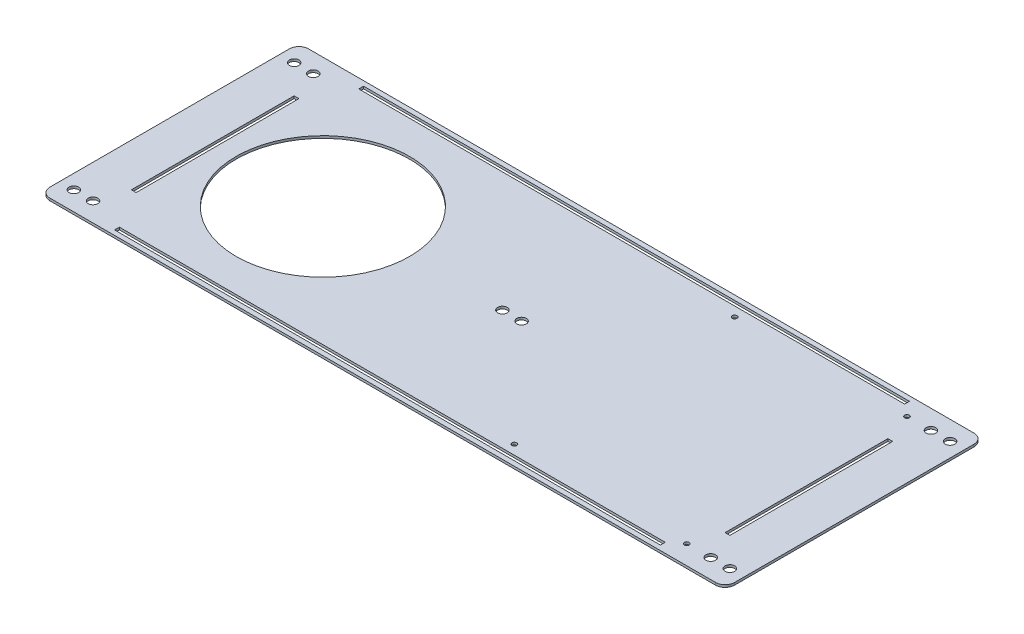
from build123d import *

# Parameters (mm, degrees)
SKETCH1_W           = 454.025
SKETCH1_H           = 171.45
BOSS_EXTRUDE1_DEPTH = 1.5875
FILLET1_R           = 6.35
SKETCH3_W           = 361.95
SKETCH3_H           = 3.175
SKETCH3_W_2         = 3.175
SKETCH3_H_2         = 107.95
CUT_EXTRUDE1_DEPTH  = 486.320845711
SKETCH4_R           = 3.175
CUT_EXTRUDE2_DEPTH  = 486.320845711
SKETCH6_R           = 1.5875
CUT_EXTRUDE3_DEPTH  = 486.320845711
SKETCH7_R           = 57.5
CUT_EXTRUDE4_DEPTH  = 486.320845711


with BuildPart() as part:
    # Sketch1 → Boss-Extrude1 (new body)
    with BuildSketch(Plane(origin=(0, 0, 0), x_dir=(1, 0, 0), z_dir=(0, 1, 0))):
        with Locations((227.0125, 85.725)):
            Rectangle(SKETCH1_W, SKETCH1_H)
    extrude(amount=BOSS_EXTRUDE1_DEPTH)

    # Fillet1
    fillet1_edges = [part.edges().sort_by_distance(p)[0] for p in [
        (0, 0.79375, -171.45),
        (454.025, 0.79375, -171.45),
        (454.025, 0.79375, 0),
        (0, 0.79375, 0),
    ]]
    fillet(fillet1_edges, radius=FILLET1_R)

    # Sketch3 → Cut-Extrude1 (cut, through all)
    with BuildSketch(Plane(origin=(0, 1.5875, 0), x_dir=(1, 0, 0), z_dir=(0, 1, 0))):
        with Locations((227.0125, 166.6875)):
            Rectangle(SKETCH3_W, SKETCH3_H)
        with Locations((30.1625, 85.725)):
            Rectangle(SKETCH3_W_2, SKETCH3_H_2)
        with Locations((227.0125, 4.7625)):
            Rectangle(SKETCH3_W, SKETCH3_H)
        with Locations((423.8625, 85.725)):
            Rectangle(SKETCH3_W_2, SKETCH3_H_2)
    extrude(amount=-CUT_EXTRUDE1_DEPTH, mode=Mode.SUBTRACT)

    # Sketch4 → Cut-Extrude2 (cut, through all)
    with BuildSketch(Plane(origin=(0, 1.5875, 0), x_dir=(1, 0, 0), z_dir=(0, 1, 0))):
        with Locations(Location((9.525, 158.75, 0), (0, 0, 270))):
            Circle(SKETCH4_R)
        with Locations(Location((22.225, 158.75, 0), (0, 0, 270))):
            Circle(SKETCH4_R)
        with Locations(Location((431.8, 158.75, 0), (0, 0, 270))):
            Circle(SKETCH4_R)
        with Locations(Location((444.5, 158.75, 0), (0, 0, 270))):
            Circle(SKETCH4_R)
        with Locations(Location((431.8, 12.7, 0), (0, 0, 270))):
            Circle(SKETCH4_R)
        with Locations(Location((444.5, 12.7, 0), (0, 0, 270))):
            Circle(SKETCH4_R)
        with Locations(Location((9.525, 12.7, 0), (0, 0, 270))):
            Circle(SKETCH4_R)
        with Locations(Location((22.225, 12.7, 0), (0, 0, 270))):
            Circle(SKETCH4_R)
        with Locations(Location((220.6625, 85.725, 0), (0, 0, 270))):
            Circle(SKETCH4_R)
        with Locations(Location((233.3625, 85.725, 0), (0, 0, 270))):
            Circle(SKETCH4_R)
    extrude(amount=-CUT_EXTRUDE2_DEPTH, mode=Mode.SUBTRACT)

    # Sketch6 → Cut-Extrude3 (cut, through all)
    with BuildSketch(Plane(origin=(0, 1.5875, 0), x_dir=(1, 0, 0), z_dir=(0, 1, 0))):
        with Locations(Location((301.625, 158.75, 0), (0, 0, 270))):
            Circle(SKETCH6_R)
        with Locations(Location((415.925, 158.75, 0), (0, 0, 270))):
            Circle(SKETCH6_R)
        with Locations(Location((415.925, 12.7, 0), (0, 0, 270))):
            Circle(SKETCH6_R)
        with Locations(Location((301.625, 12.7, 0), (0, 0, 270))):
            Circle(SKETCH6_R)
    extrude(amount=-CUT_EXTRUDE3_DEPTH, mode=Mode.SUBTRACT)

    # Sketch7 → Cut-Extrude4 (cut, through all)
    with BuildSketch(Plane(origin=(0, 1.5875, 0), x_dir=(1, 0, 0), z_dir=(0, 1, 0))):
        with Locations(Location((101.6, 85.725, 0), (0, 0, 270))):
            Circle(SKETCH7_R)
    extrude(amount=-CUT_EXTRUDE4_DEPTH, mode=Mode.SUBTRACT)


solid = part.part
